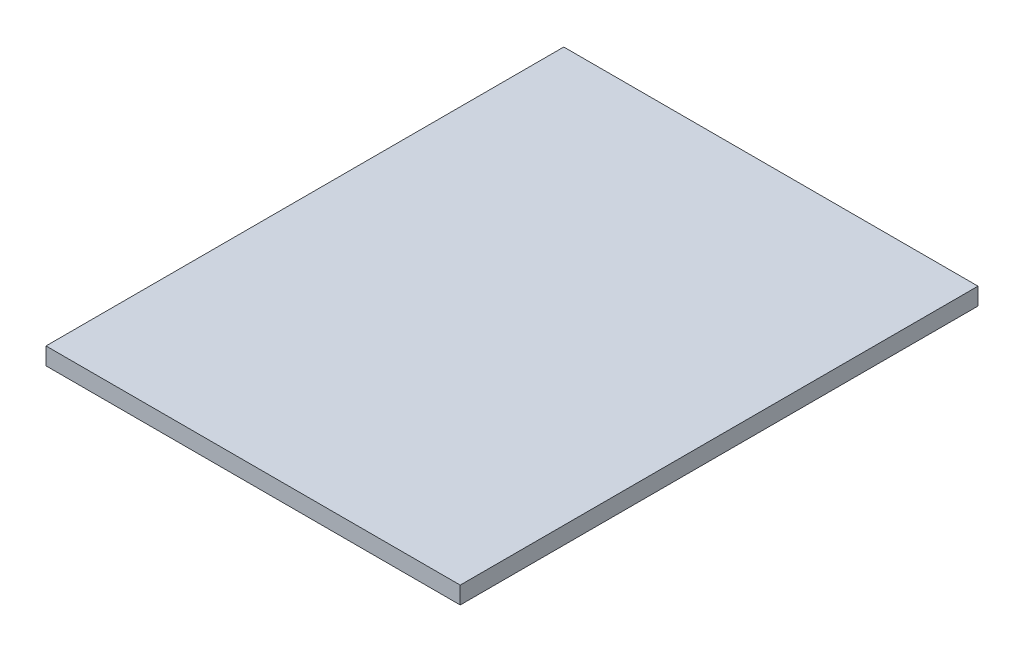
from build123d import *

# Parameters (mm, degrees)
SKETCH1_W           = 120
SKETCH1_H           = 150
BOSS_EXTRUDE1_DEPTH = 5


with BuildPart() as part:
    # Sketch1 → Boss-Extrude1 (new body)
    with BuildSketch(Plane(origin=(0, 0, 0), x_dir=(1, 0, 0), z_dir=(0, 1, 0))):
        Rectangle(SKETCH1_W, SKETCH1_H)
    extrude(amount=BOSS_EXTRUDE1_DEPTH)


solid = part.part
